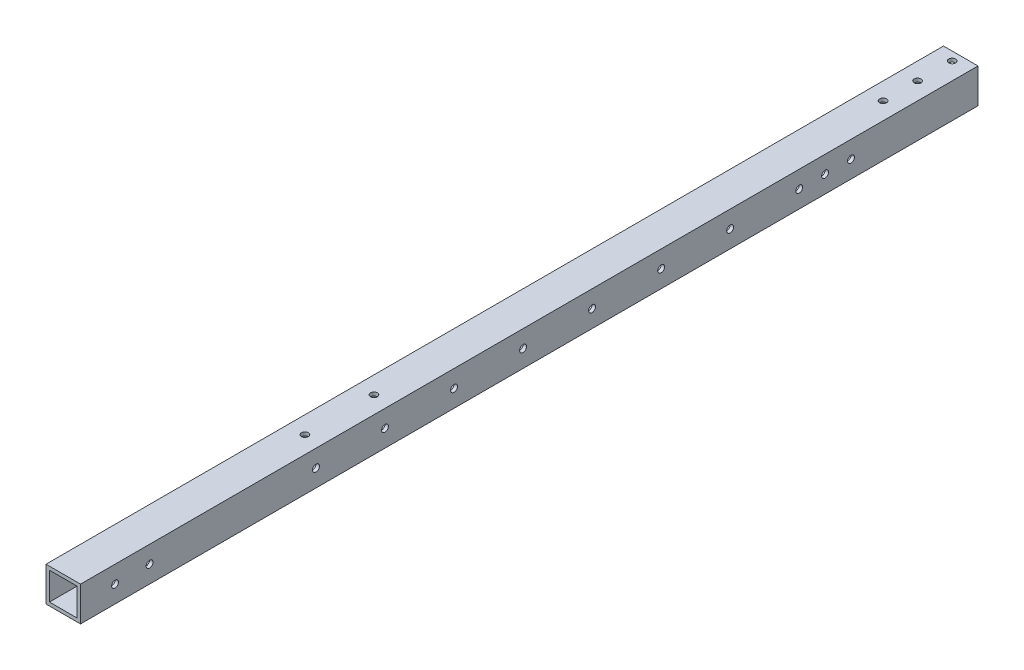
from build123d import *

# Parameters (mm, degrees)
SKETCH_1_W          = 20
SKETCH_1_H          = 20
SKETCH_1_W_2        = 16
SKETCH_1_H_2        = 16
EXTRUDE_1_DEPTH     = 520
SKETCH_2_R          = 2
CUT_EXTRUDE_1_DEPTH = 521.480547187
SKETCH_3_R          = 2
CUT_EXTRUDE_2_DEPTH = 521.480547187
SKETCH_4_R          = 2
CUT_EXTRUDE_3_DEPTH = 521.480547187
SKETCH_5_R          = 2
CUT_EXTRUDE_4_DEPTH = 521.480547187


with BuildPart() as part:
    # 草图1 → 凸台-拉伸1 (new body)
    with BuildSketch(Plane.XY):
        Rectangle(SKETCH_1_W, SKETCH_1_H)
        Rectangle(SKETCH_1_W_2, SKETCH_1_H_2, mode=Mode.SUBTRACT)
    extrude(amount=EXTRUDE_1_DEPTH)

    # 草图2 → 切除-拉伸1 (cut, through all)
    with BuildSketch(Plane.XZ.offset(10)):
        with Locations((0, 5)):
            Circle(SKETCH_2_R)
        with Locations((0, 25)):
            Circle(SKETCH_2_R)
        with Locations((0, 45)):
            Circle(SKETCH_2_R)
    extrude(amount=-CUT_EXTRUDE_1_DEPTH, mode=Mode.SUBTRACT)

    # 草图3 → 切除-拉伸2 (cut, through all)
    with BuildSketch(Plane(origin=(10, 0, 0), x_dir=(0, 0, -1), z_dir=(1, 0, 0))):
        with Locations(Location((-500, 0, 0), (0, 0, 90))):
            Circle(SKETCH_3_R)
        with Locations(Location((-480, 0, 0), (0, 0, 90))):
            Circle(SKETCH_3_R)
    extrude(amount=-CUT_EXTRUDE_2_DEPTH, mode=Mode.SUBTRACT)

    # 草图4 → 切除-拉伸3 (cut, through all)
    with BuildSketch(Plane(origin=(10, 0, 0), x_dir=(0, 0, -1), z_dir=(1, 0, 0))):
        with Locations(Location((-103.589838486, 0, 0), (0, 0, 90))):
            Circle(SKETCH_4_R)
        with Locations(Location((-88.589838486, 0, 0), (0, 0, 90))):
            Circle(SKETCH_4_R)
        with Locations(Location((-73.589838486, 0, 0), (0, 0, 90))):
            Circle(SKETCH_4_R)
        with Locations(Location((-143.589838486, 0, 0), (0, 0, 90))):
            Circle(SKETCH_4_R)
        with Locations(Location((-183.589838486, 0, 0), (0, 0, 90))):
            Circle(SKETCH_4_R)
        with Locations(Location((-223.589838486, 0, 0), (0, 0, 90))):
            Circle(SKETCH_4_R)
        with Locations(Location((-263.589838486, 0, 0), (0, 0, 90))):
            Circle(SKETCH_4_R)
        with Locations(Location((-303.589838486, 0, 0), (0, 0, 90))):
            Circle(SKETCH_4_R)
        with Locations(Location((-343.589838486, 0, 0), (0, 0, 90))):
            Circle(SKETCH_4_R)
        with Locations(Location((-383.589838486, 0, 0), (0, 0, 90))):
            Circle(SKETCH_4_R)
    extrude(amount=-CUT_EXTRUDE_3_DEPTH, mode=Mode.SUBTRACT)

    # 草图5 → 切除-拉伸4 (cut, through all)
    with BuildSketch(Plane.XZ.offset(10)):
        with Locations((0, 380)):
            Circle(SKETCH_5_R)
        with Locations((0, 340)):
            Circle(SKETCH_5_R)
    extrude(amount=-CUT_EXTRUDE_4_DEPTH, mode=Mode.SUBTRACT)


solid = part.part
